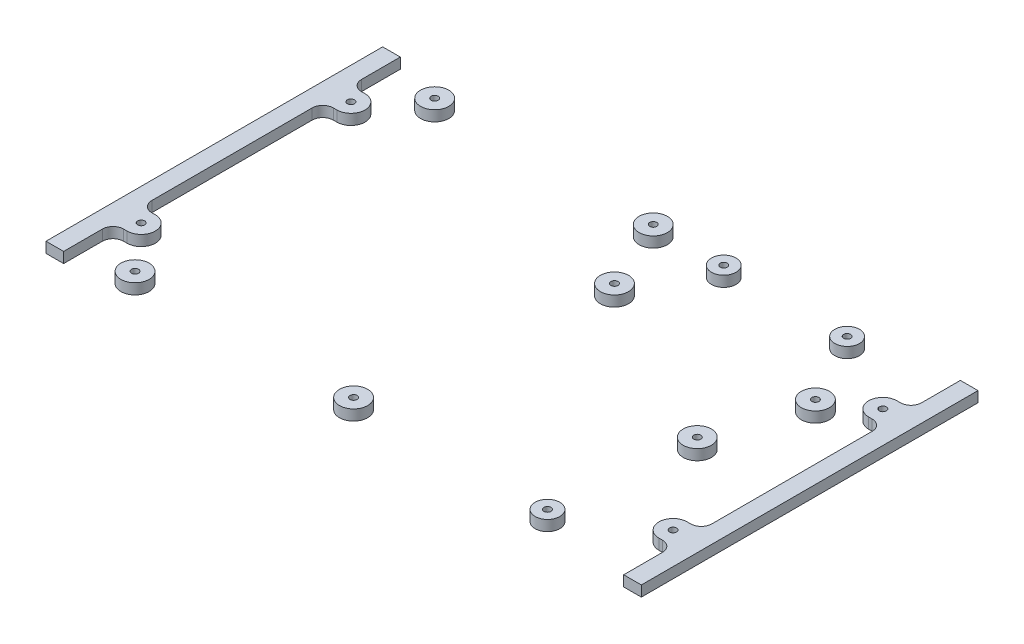
from build123d import *

# Parameters (mm, degrees)
SKETCH1_R                                    = 4
SKETCH1_R_2                                  = 1
LEVEL_2_INTERFACE_AND_AMP_SCREWHOLES_DEPTH   = 3
LEVEL_2_INTERFACE_AND_AMP_SCREWHOLES_2_DEPTH = 3
LEVEL_2_INTERFACE_AND_AMP_SCREWHOLES_3_DEPTH = 3
LEVEL_2_INTERFACE_AND_AMP_SCREWHOLES_4_DEPTH = 3
LEVEL_2_INTERFACE_AND_AMP_SCREWHOLES_5_DEPTH = 3
LEVEL_2_INTERFACE_AND_AMP_SCREWHOLES_6_DEPTH = 3
SKETCH2_R                                    = 3.5
SKETCH2_R_2                                  = 1
SOUND_CARD_SCREWHOLES_DEPTH                  = 3
SOUND_CARD_SCREWHOLES_2_DEPTH                = 3
SOUND_CARD_SCREWHOLES_3_DEPTH                = 3
SKETCH3_R                                    = 4
SKETCH3_R_2                                  = 1
BOSS_EXTRUDE3_DEPTH                          = 3
BOSS_EXTRUDE3_2_DEPTH                        = 3
BOSS_EXTRUDE3_3_DEPTH                        = 3


with BuildPart() as part:
    # Sketch1 → LEVEL 2 interface and amp screwholes (new body)
    with BuildSketch(Plane(origin=(0, 38, 0), x_dir=(1, 0, 0), z_dir=(0, 1, 0))):
        with Locations(Location((-33.874988464, -85.999994444, 0), (0, 0, 270))):
            Circle(SKETCH1_R)
        with Locations(Location((-33.874988464, -85.999994444, 0), (0, 0, 270))):
            Circle(SKETCH1_R_2, mode=Mode.SUBTRACT)
    extrude(amount=LEVEL_2_INTERFACE_AND_AMP_SCREWHOLES_DEPTH)


with BuildPart() as body_2:
    # Sketch1 → LEVEL 2 interface and amp screwholes 2 (new body)
    with BuildSketch(Plane(origin=(0, 38, 0), x_dir=(1, 0, 0), z_dir=(0, 1, 0))):
        with Locations(Location((28.125011536, -85.999994444, 0), (0, 0, 270))):
            Circle(SKETCH1_R)
        with Locations(Location((28.125011536, -85.999994444, 0), (0, 0, 270))):
            Circle(SKETCH1_R_2, mode=Mode.SUBTRACT)
    extrude(amount=LEVEL_2_INTERFACE_AND_AMP_SCREWHOLES_2_DEPTH)


with BuildPart() as body_3:
    # Sketch1 → LEVEL 2 interface and amp screwholes 3 (new body)
    with BuildSketch(Plane(origin=(0, 38, 0), x_dir=(1, 0, 0), z_dir=(0, 1, 0))):
        with Locations(Location((28.125011536, -0.999994444, 0), (0, 0, 270))):
            Circle(SKETCH1_R)
        with Locations(Location((28.125011536, -0.999994444, 0), (0, 0, 270))):
            Circle(SKETCH1_R_2, mode=Mode.SUBTRACT)
    extrude(amount=LEVEL_2_INTERFACE_AND_AMP_SCREWHOLES_3_DEPTH)


with BuildPart() as body_4:
    # Sketch1 → LEVEL 2 interface and amp screwholes 4 (new body)
    with BuildSketch(Plane(origin=(0, 38, 0), x_dir=(1, 0, 0), z_dir=(0, 1, 0))):
        with Locations(Location((-33.874988464, -0.999994444, 0), (0, 0, 270))):
            Circle(SKETCH1_R)
        with Locations(Location((-33.874988464, -0.999994444, 0), (0, 0, 270))):
            Circle(SKETCH1_R_2, mode=Mode.SUBTRACT)
    extrude(amount=LEVEL_2_INTERFACE_AND_AMP_SCREWHOLES_4_DEPTH)


with BuildPart() as body_5:
    # Sketch1 → LEVEL 2 interface and amp screwholes 5 (new body)
    with BuildSketch(Plane(origin=(0, 38, 0), x_dir=(1, 0, 0), z_dir=(0, 1, 0))):
        with BuildLine():
            Line((-53.874988464, 4.250005556), (-53.874988464, -91.249994444))
            Line((-53.874988464, -91.249994444), (-48.874988464, -91.249994444))
            Line((-48.874988464, -91.249994444), (-48.874988464, -80.249990415))
            ThreePointArc((-48.874988464, -80.249990415), (-47.996308807, -78.128670072), (-45.874988464, -77.249990415))
            Line((-45.874988464, -77.249990415), (-44.874988464, -77.249990415))
            ThreePointArc((-44.874988464, -77.249990415), (-40.874988464, -73.249990415), (-44.874988464, -69.249990415))
            Line((-44.874988464, -69.249990415), (-45.874988464, -69.249990415))
            ThreePointArc((-45.874988464, -69.249990415), (-47.996308807, -68.371310759), (-48.874988464, -66.249990415))
            Line((-48.874988464, -66.249990415), (-48.874988464, -20.75))
            ThreePointArc((-48.874988464, -20.75), (-47.996308807, -18.628679656), (-45.874988464, -17.75))
            Line((-45.874988464, -17.75), (-44.874988464, -17.75))
            ThreePointArc((-44.874988464, -17.75), (-40.874988464, -13.75), (-44.874988464, -9.75))
            Line((-44.874988464, -9.75), (-45.874988464, -9.75))
            ThreePointArc((-45.874988464, -9.75), (-47.996308807, -8.871320344), (-48.874988464, -6.75))
            Line((-48.874988464, -6.75), (-48.874988464, 4.250005556))
            Line((-48.874988464, 4.250005556), (-53.874988464, 4.250005556))
        make_face()
        with Locations(Location((-44.874988464, -13.75, 0), (0, 0, 270))):
            Circle(SKETCH1_R_2, mode=Mode.SUBTRACT)
        with Locations(Location((-44.874988464, -73.249990415, 0), (0, 0, 270))):
            Circle(SKETCH1_R_2, mode=Mode.SUBTRACT)
    extrude(amount=LEVEL_2_INTERFACE_AND_AMP_SCREWHOLES_5_DEPTH)


with BuildPart() as body_6:
    # Sketch1 → LEVEL 2 interface and amp screwholes 6 (new body)
    with BuildSketch(Plane(origin=(0, 38, 0), x_dir=(1, 0, 0), z_dir=(0, 1, 0))):
        with BuildLine():
            Line((110, 4.250004792), (110, -6.75))
            ThreePointArc((110, -6.75), (109.121320344, -8.871320344), (107, -9.75))
            Line((107, -9.75), (106, -9.75))
            ThreePointArc((106, -9.75), (102, -13.75), (106, -17.75))
            Line((106, -17.75), (107, -17.75))
            ThreePointArc((107, -17.75), (109.121320344, -18.628679656), (110, -20.75))
            Line((110, -20.75), (110, -66.249990415))
            ThreePointArc((110, -66.249990415), (109.121320344, -68.371310759), (107, -69.249990415))
            Line((107, -69.249990415), (106, -69.249990415))
            ThreePointArc((106, -69.249990415), (102, -73.249990415), (106, -77.249990415))
            Line((106, -77.249990415), (107, -77.249990415))
            ThreePointArc((107, -77.249990415), (109.121320344, -78.128670072), (110, -80.249990415))
            Line((110, -80.249990415), (110, -91.249995208))
            Line((110, -91.249995208), (115, -91.249995208))
            Line((115, -91.249995208), (115, 4.250004792))
            Line((115, 4.250004792), (110, 4.250004792))
        make_face()
        with Locations(Location((106, -13.75, 0), (0, 0, 270))):
            Circle(SKETCH1_R_2, mode=Mode.SUBTRACT)
        with Locations(Location((106, -73.249990415, 0), (0, 0, 270))):
            Circle(SKETCH1_R_2, mode=Mode.SUBTRACT)
    extrude(amount=LEVEL_2_INTERFACE_AND_AMP_SCREWHOLES_6_DEPTH)


with BuildPart() as body_7:
    # Sketch2 → Sound card screwholes (new body)
    with BuildSketch(Plane(origin=(0, 41, 0), x_dir=(1, 0, 0), z_dir=(0, 1, 0))):
        with Locations(Location((48.125011536, -0.999994444, 0), (0, 0, 270))):
            Circle(SKETCH2_R)
        with Locations(Location((48.125011536, -0.999994444, 0), (0, 0, 270))):
            Circle(SKETCH2_R_2, mode=Mode.SUBTRACT)
    extrude(amount=-SOUND_CARD_SCREWHOLES_DEPTH)


with BuildPart() as body_8:
    # Sketch2 → Sound card screwholes 2 (new body)
    with BuildSketch(Plane(origin=(0, 41, 0), x_dir=(1, 0, 0), z_dir=(0, 1, 0))):
        with Locations(Location((83.125011536, -0.999994444, 0), (0, 0, 270))):
            Circle(SKETCH2_R)
        with Locations(Location((83.125011536, -0.999994444, 0), (0, 0, 270))):
            Circle(SKETCH2_R_2, mode=Mode.SUBTRACT)
    extrude(amount=-SOUND_CARD_SCREWHOLES_2_DEPTH)


with BuildPart() as body_9:
    # Sketch2 → Sound card screwholes 3 (new body)
    with BuildSketch(Plane(origin=(0, 41, 0), x_dir=(1, 0, 0), z_dir=(0, 1, 0))):
        with Locations(Location((83.125011536, -85.999994444, 0), (0, 0, 270))):
            Circle(SKETCH2_R)
        with Locations(Location((83.125011536, -85.999994444, 0), (0, 0, 270))):
            Circle(SKETCH2_R_2, mode=Mode.SUBTRACT)
    extrude(amount=-SOUND_CARD_SCREWHOLES_3_DEPTH)


with BuildPart() as body_10:
    # Sketch3 → Boss-Extrude3 (new body)
    with BuildSketch(Plane(origin=(0, 41, 0), x_dir=(1, 0, 0), z_dir=(0, 1, 0))):
        with Locations(Location((94.125011536, -20.999994444, 0), (0, 0, 270))):
            Circle(SKETCH3_R)
        with Locations(Location((94.125011536, -20.999994444, 0), (0, 0, 270))):
            Circle(SKETCH3_R_2, mode=Mode.SUBTRACT)
    extrude(amount=-BOSS_EXTRUDE3_DEPTH)


with BuildPart() as body_11:
    # Sketch3 → Boss-Extrude3 2 (new body)
    with BuildSketch(Plane(origin=(0, 41, 0), x_dir=(1, 0, 0), z_dir=(0, 1, 0))):
        with Locations(Location((86.625011536, -46.999994444, 0), (0, 0, 270))):
            Circle(SKETCH3_R)
        with Locations(Location((86.625011536, -46.999994444, 0), (0, 0, 270))):
            Circle(SKETCH3_R_2, mode=Mode.SUBTRACT)
    extrude(amount=-BOSS_EXTRUDE3_2_DEPTH)


with BuildPart() as body_12:
    # Sketch3 → Boss-Extrude3 3 (new body)
    with BuildSketch(Plane(origin=(0, 41, 0), x_dir=(1, 0, 0), z_dir=(0, 1, 0))):
        with Locations(Location((37.125011536, -20.999994444, 0), (0, 0, 270))):
            Circle(SKETCH3_R)
        with Locations(Location((37.125011536, -20.999994444, 0), (0, 0, 270))):
            Circle(SKETCH3_R_2, mode=Mode.SUBTRACT)
    extrude(amount=-BOSS_EXTRUDE3_3_DEPTH)


solid = Compound([part.part, body_2.part, body_3.part, body_4.part, body_5.part, body_6.part, body_7.part, body_8.part, body_9.part, body_10.part, body_11.part, body_12.part])
